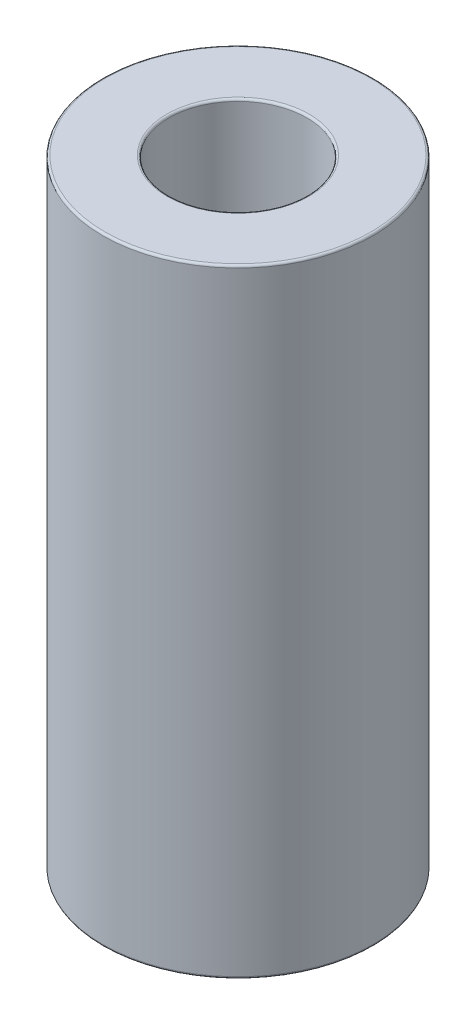
from build123d import *

# Parameters (mm, degrees)
SKETCH1_R           = 6.125
SKETCH1_R_2         = 3.125
EXTRUDE_THIN1_DEPTH = 28
FILLET1_R           = 0.1


with BuildPart() as part:
    # Sketch1 → Extrude-Thin1 (new body)
    with BuildSketch(Plane(origin=(0, 0, 0), x_dir=(1, 0, 0), z_dir=(0, 1, 0))):
        Circle(SKETCH1_R)
        Circle(SKETCH1_R_2, mode=Mode.SUBTRACT)
    extrude(amount=EXTRUDE_THIN1_DEPTH)

    # Fillet1
    fillet1_edges = [part.edges().sort_by_distance(p)[0] for p in [
        (-6.125, 0, 0),
        (-6.125, 28, 0),
        (-3.125, 0, 0),
        (-3.125, 28, 0),
    ]]
    fillet(fillet1_edges, radius=FILLET1_R)


solid = part.part
